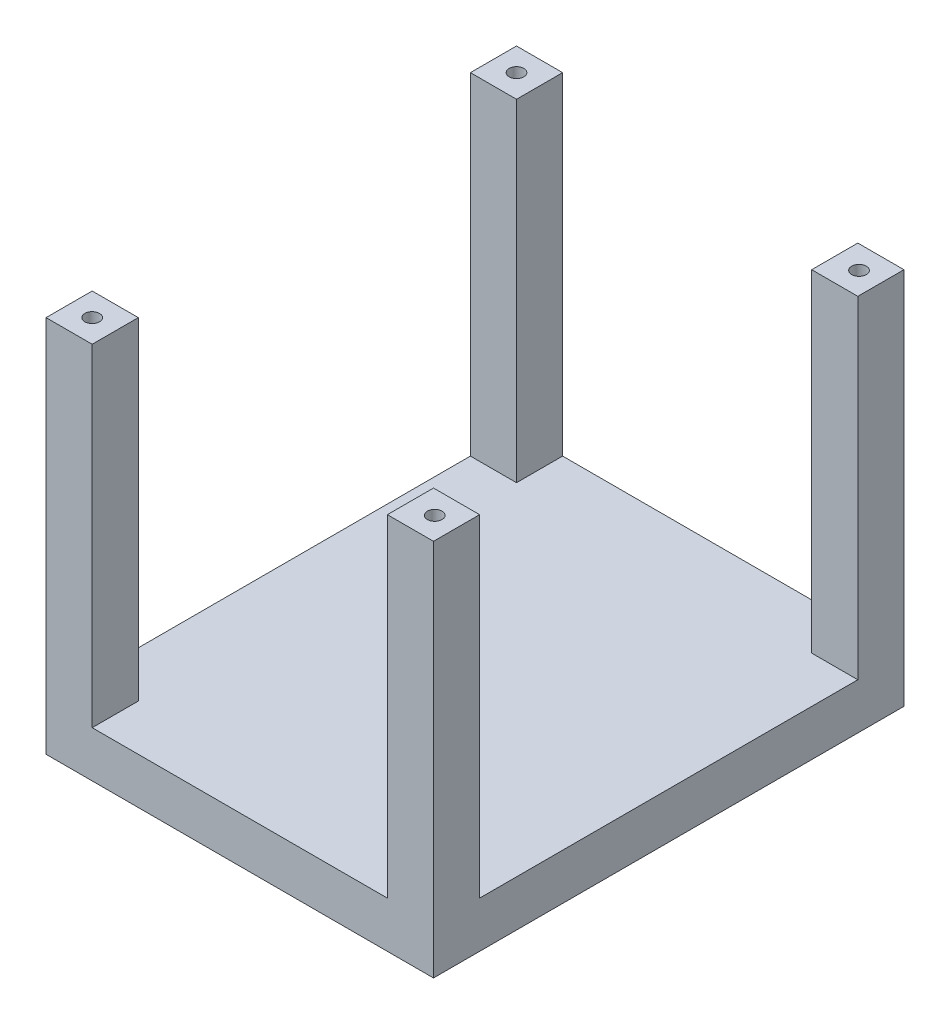
from build123d import *

# Parameters (mm, degrees)
CROQUIS1_W                = 5
CROQUIS1_H                = 5
SALIENTE_EXTRUIR1_DEPTH   = 41
SALIENTE_EXTRUIR1_2_DEPTH = 41
SALIENTE_EXTRUIR1_3_DEPTH = 41
SALIENTE_EXTRUIR1_4_DEPTH = 41
CROQUIS2_W                = 42
CROQUIS2_H                = 51
SALIENTE_EXTRUIR2_DEPTH   = 5
CROQUIS3_R                = 0.79375
CORTAR_EXTRUIR1_DEPTH     = 41


with BuildPart() as part:
    # Croquis1 → Saliente-Extruir1 (new body)
    with BuildSketch(Plane(origin=(0, 0, 0), x_dir=(1, 0, 0), z_dir=(0, 1, 0))):
        with Locations((-18.565940407, 9.143956682)):
            Rectangle(CROQUIS1_W, CROQUIS1_H)
    extrude(amount=SALIENTE_EXTRUIR1_DEPTH)



with BuildPart() as body_2:
    # Croquis1 → Saliente-Extruir1 2 (new body)
    with BuildSketch(Plane(origin=(0, 0, 0), x_dir=(1, 0, 0), z_dir=(0, 1, 0))):
        with Locations((18.434059593, 9.143956682)):
            Rectangle(CROQUIS1_W, CROQUIS1_H)
    extrude(amount=SALIENTE_EXTRUIR1_2_DEPTH)


with BuildPart() as body_3:
    # Croquis1 → Saliente-Extruir1 3 (new body)
    with BuildSketch(Plane(origin=(0, 0, 0), x_dir=(1, 0, 0), z_dir=(0, 1, 0))):
        with Locations((-18.565940407, -36.856043318)):
            Rectangle(CROQUIS1_W, CROQUIS1_H)
    extrude(amount=SALIENTE_EXTRUIR1_3_DEPTH)


with BuildPart() as body_4:
    # Croquis1 → Saliente-Extruir1 4 (new body)
    with BuildSketch(Plane(origin=(0, 0, 0), x_dir=(1, 0, 0), z_dir=(0, 1, 0))):
        with Locations((18.434059593, -36.856043318)):
            Rectangle(CROQUIS1_W, CROQUIS1_H)
    extrude(amount=SALIENTE_EXTRUIR1_4_DEPTH)


with BuildPart() as part_1:
    add(part.part)

    add(body_2.part)  # Saliente-Extruir2 merges body 2

    add(body_3.part)  # Saliente-Extruir2 merges body 3

    add(body_4.part)  # Saliente-Extruir2 merges body 4
    # Croquis2 → Saliente-Extruir2 (add)
    with BuildSketch(Plane(origin=(0, 0, 0), x_dir=(1, 0, 0), z_dir=(0, 1, 0))):
        with Locations((-0.065940407, -13.856043318)):
            Rectangle(CROQUIS2_W, CROQUIS2_H)
    extrude(amount=SALIENTE_EXTRUIR2_DEPTH)

    # Croquis3 → Cortar-Extruir1 (cut)
    with BuildSketch(Plane(origin=(0, 41, 0), x_dir=(1, 0, 0), z_dir=(0, 1, 0))):
        with Locations(Location((-18.565940407, 9.143956682, 0), (0, 0, 270))):
            Circle(CROQUIS3_R)
        with Locations(Location((-18.565940407, -36.856043318, 0), (0, 0, 270))):
            Circle(CROQUIS3_R)
    cortar_extruir1 = extrude(amount=-CORTAR_EXTRUIR1_DEPTH, mode=Mode.SUBTRACT)

    # Simetría1: Cortar-Extruir1 across plane
    add(cortar_extruir1.mirror(Plane(origin=(0, 0, 0), x_dir=(0, 0, 1), z_dir=(1, 0, 0))), mode=Mode.SUBTRACT)


solid = part_1.part
